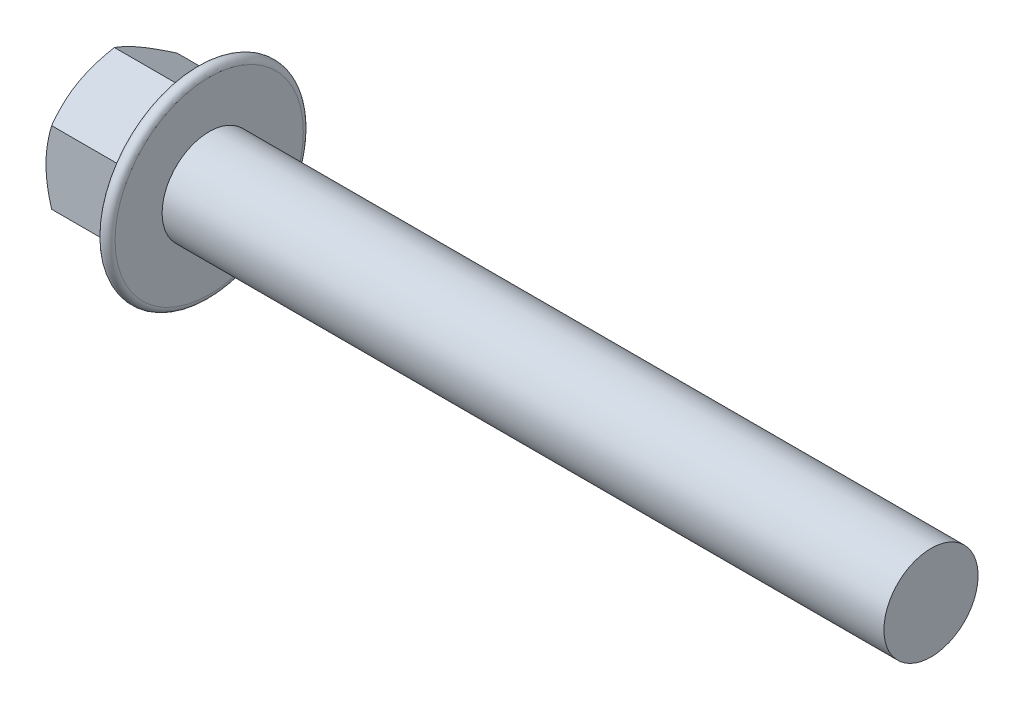
from build123d import *

# Parameters (mm, degrees)
SKETCH2_R         = 2.33256351
HEX_DIE_DEPTH     = 3.2
FLANGEHEXFILLET_R = 0.2
SKETCH4_R         = 1.75
INDENT_DEPTH      = 0.266666667


with BuildPart() as part:
    # BodySke → Base-Revolve (revolve)
    with BuildSketch(Plane.XY, mode=Mode.PRIVATE) as base_revolve_sk:
        Polygon((3.2, 1.5), (3.2, 2.309468822), (0.178671908, 2.309468822), (0, 2), (0, 0), (26.2, 0), (26.2, 1.5), align=None)
    revolve(base_revolve_sk.sketch.rotate(Axis((-25.4, 0, 0), (1, 0, 0)), 90), axis=Axis((-25.4, 0, 0), (1, 0, 0)))

    # Sketch2 → Hex-Die (cut)
    with BuildSketch(Plane(origin=(0, 0, 0), x_dir=(0, 0, -1), z_dir=(1, 0, 0))):
        Circle(SKETCH2_R)
        Polygon((-2, 1.154700543), (0, 2.309401087), (2, 1.154700543), (2, -1.154700543), (0, -2.309401087), (-2, -1.154700543), align=None, mode=Mode.SUBTRACT)
    extrude(amount=HEX_DIE_DEPTH, mode=Mode.SUBTRACT)

    # Sketch5 → Flange (revolve)
    with BuildSketch(Plane.XY, mode=Mode.PRIVATE) as flange_sk:
        with BuildLine():
            Line((1.695253743, 0), (2.812061476, 3.068404029))
            ThreePointArc((2.812061476, 3.068404029), (3.034729636, 3.196961551), (3.2, 3))
            Line((3.2, 3), (3.2, 0))
            Line((3.2, 0), (1.695253743, 0))
        make_face()
    revolve(flange_sk.sketch.rotate(Axis((0, 0, 0), (1, 0, 0)), 90), axis=Axis((0, 0, 0), (1, 0, 0)))

    # FlangeHexFillet
    flangehexfillet_edges = [part.edges().sort_by_distance(p)[0] for p in [
        (2.453172961, 0.579868861, 2),
        (2.423194214, 1.732050815, 1),
        (2.423194214, 1.732050815, -1),
        (2.423194211, 0, -2),
        (2.423194214, -1.732050815, -1),
        (2.423194214, -1.732050815, 1),
        (2.453172961, -0.579868861, 2),
    ]]
    fillet(flangehexfillet_edges, radius=FLANGEHEXFILLET_R)

    # Sketch4 → Indent (cut)
    with BuildSketch(Plane(origin=(0, 0, 0), x_dir=(0, 0, -1), z_dir=(1, 0, 0))):
        Circle(SKETCH4_R)
    extrude(amount=INDENT_DEPTH, mode=Mode.SUBTRACT)


solid = part.part
